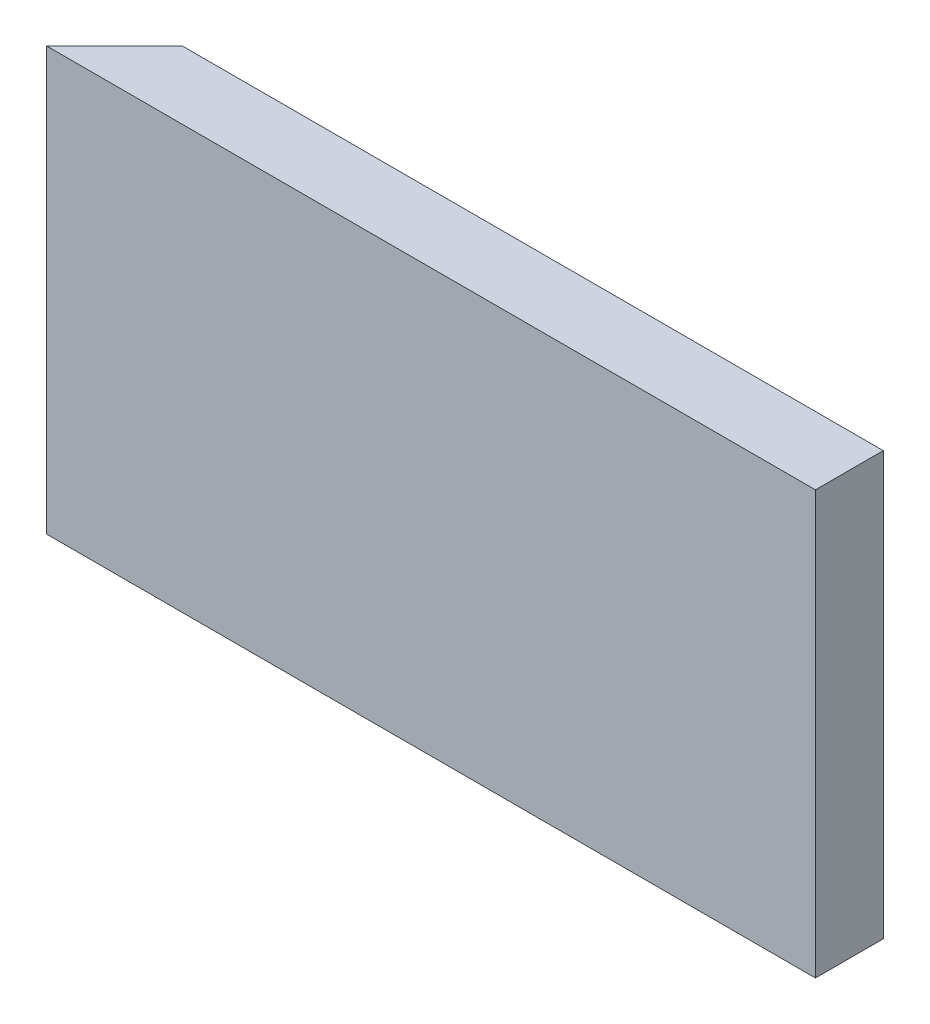
from build123d import *

# Parameters (mm, degrees)
SKETCH1_W           = 19.05
SKETCH1_H           = 118.745
BOSS_EXTRUDE1_DEPTH = 215.9
CUT_EXTRUDE5_DEPTH  = 215.9


with BuildPart() as part:
    # Sketch1 → Boss-Extrude1 (new body)
    with BuildSketch(Plane(origin=(0, 0, 0), x_dir=(0, 0, -1), z_dir=(1, 0, 0))):
        with Locations((9.525, 59.3725)):
            Rectangle(SKETCH1_W, SKETCH1_H)
    extrude(amount=BOSS_EXTRUDE1_DEPTH)

    # Sketch2 → Cut-Extrude5 (cut)
    with BuildSketch(Plane(origin=(0, 0, 0), x_dir=(1, 0, 0), z_dir=(0, 1, 0))):
        Polygon((0, 0), (19.05, 19.05), (0, 19.05), align=None)
    extrude(amount=CUT_EXTRUDE5_DEPTH, mode=Mode.SUBTRACT)


solid = part.part
